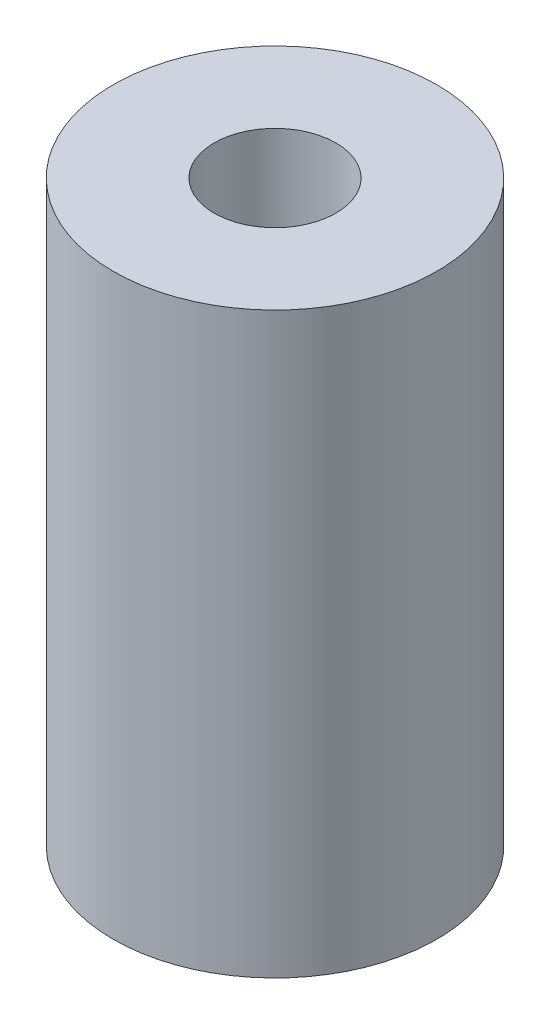
from build123d import *

# Parameters (mm, degrees)
SKETCH2_R      = 42.6085
SKETCH2_R_2    = 16.0401
EXTRUDE1_DEPTH = 152.4


with BuildPart() as part:
    # Sketch2 → Extrude1 (new body)
    with BuildSketch(Plane(origin=(0, 0, 0), x_dir=(1, 0, 0), z_dir=(0, 1, 0))):
        with Locations(Location((0, 0, 0), (0, 0, 90))):
            Circle(SKETCH2_R)
        with Locations(Location((0, 0, 0), (0, 0, 90))):
            Circle(SKETCH2_R_2, mode=Mode.SUBTRACT)
    extrude(amount=EXTRUDE1_DEPTH)


solid = part.part
